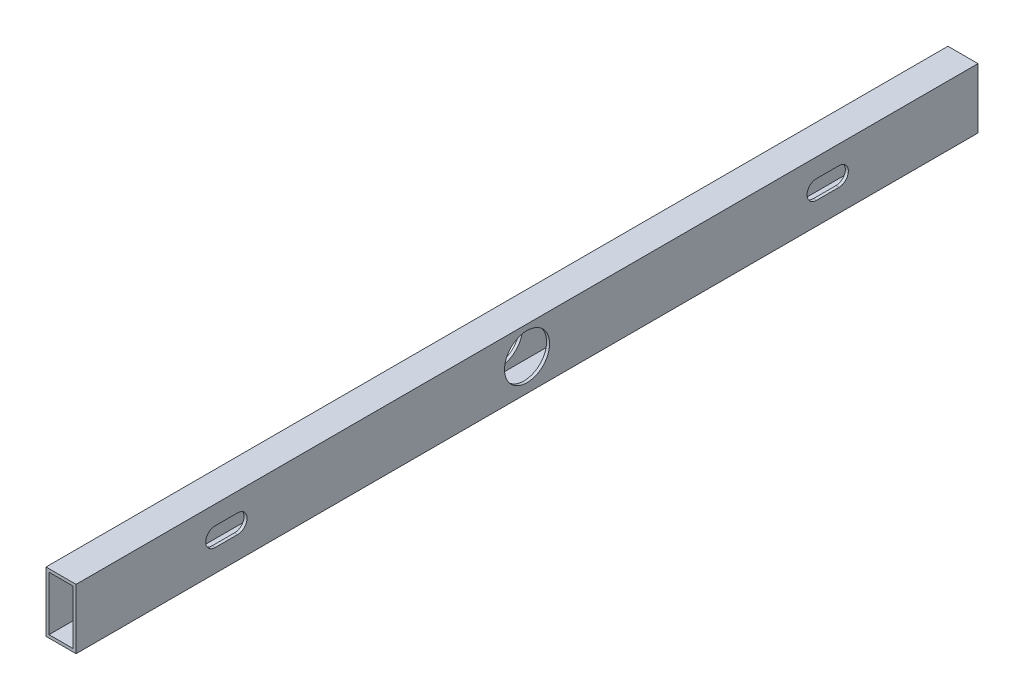
from build123d import *

# Parameters (mm, degrees)
SKETCH1_W           = 25.4
SKETCH1_H           = 50.8
SKETCH1_W_2         = 20.32
SKETCH1_H_2         = 45.72
EXTRUDE_THIN1_DEPTH = 381
SKETCH3_R           = 19.05
CUT_EXTRUDE1_DEPTH  = 383.689587002


with BuildPart() as part:
    # Sketch1 → Extrude-Thin1 (new, symmetric)
    with BuildSketch(Plane.XY):
        Rectangle(SKETCH1_W, SKETCH1_H)
        Rectangle(SKETCH1_W_2, SKETCH1_H_2, mode=Mode.SUBTRACT)
    extrude(amount=EXTRUDE_THIN1_DEPTH, both=True)

    # Sketch3 → Cut-Extrude1 (cut, through all)
    with BuildSketch(Plane(origin=(12.7, 0, 0), x_dir=(0, 0, -1), z_dir=(1, 0, 0))):
        with Locations((0, 1.524)):
            Circle(SKETCH3_R)
        with BuildLine():
            Line((244.475, 9.4615), (263.525, 9.4615))
            ThreePointArc((263.525, 9.4615), (271.4625, 1.524), (263.525, -6.4135))
            Line((263.525, -6.4135), (244.475, -6.4135))
            ThreePointArc((244.475, -6.4135), (236.5375, 1.524), (244.475, 9.4615))
        make_face()
        with BuildLine():
            Line((-244.475, 9.4615), (-263.525, 9.4615))
            ThreePointArc((-263.525, 9.4615), (-271.4625, 1.524), (-263.525, -6.4135))
            Line((-263.525, -6.4135), (-244.475, -6.4135))
            ThreePointArc((-244.475, -6.4135), (-236.5375, 1.524), (-244.475, 9.4615))
        make_face()
    extrude(amount=-CUT_EXTRUDE1_DEPTH, mode=Mode.SUBTRACT)


solid = part.part
